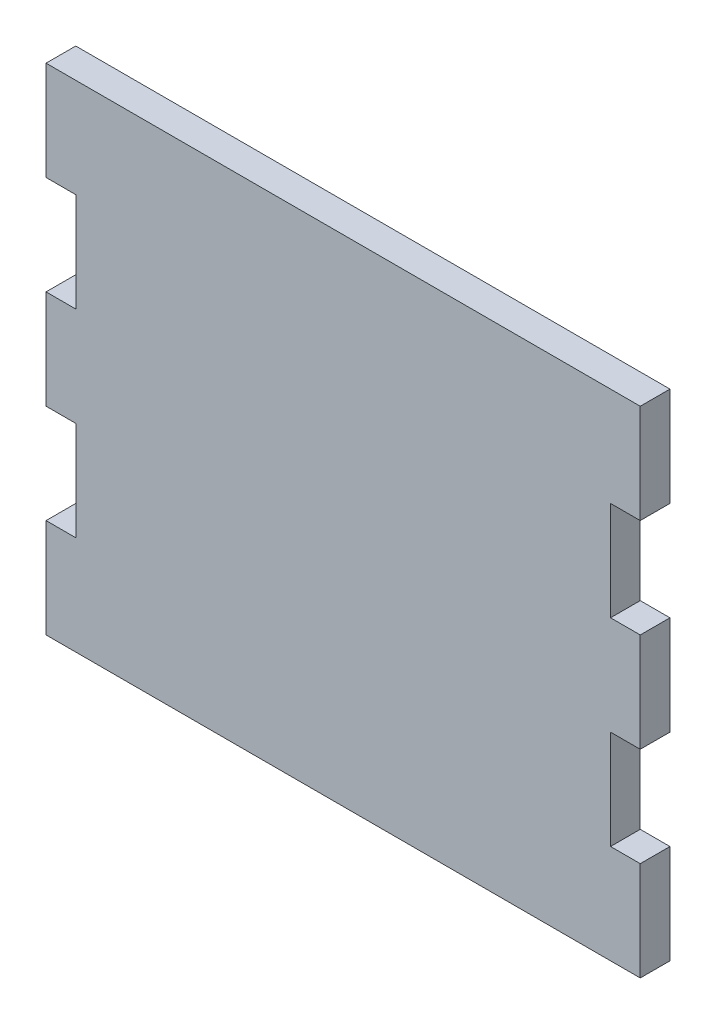
from build123d import *

# Parameters (mm, degrees)
BOSS_EXTRUDE1_DEPTH = 3


with BuildPart() as part:
    # Sketch1 → Boss-Extrude1 (new body)
    with BuildSketch(Plane.XY):
        Polygon((30, 10), (30, 20), (12.857864376, 20), (-30, 20), (-30, 10), (-27, 10), (-27, 0), (-30, 0), (-30, -10), (-27, -10), (-27, -20), (-30, -20), (-30, -30), (27, -30), (30, -30), (30, -20), (27, -20), (27, -10), (30, -10), (30, 0), (27, 0), (27, 10), align=None)
    extrude(amount=BOSS_EXTRUDE1_DEPTH)


solid = part.part
